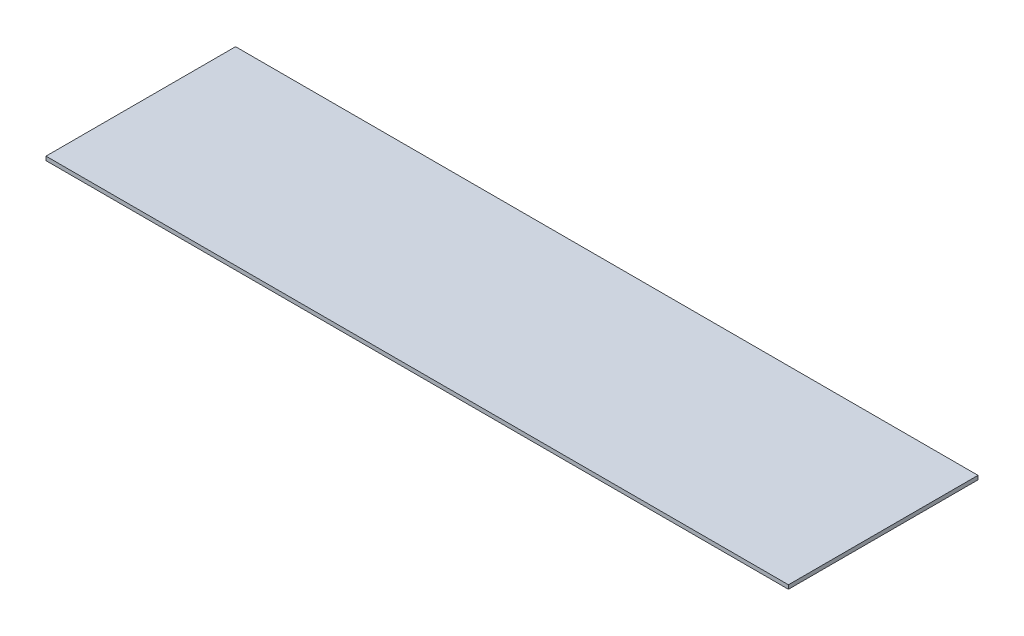
from build123d import *

# Parameters (mm, degrees)
SKETCH1_W           = 596.9
SKETCH1_H           = 152.4
BOSS_EXTRUDE1_DEPTH = 3.175


with BuildPart() as part:
    # Sketch1 → Boss-Extrude1 (new body)
    with BuildSketch(Plane(origin=(0, 0, 0), x_dir=(1, 0, 0), z_dir=(0, 1, 0))):
        with Locations((298.45, 76.2)):
            Rectangle(SKETCH1_W, SKETCH1_H)
    extrude(amount=BOSS_EXTRUDE1_DEPTH)


solid = part.part
